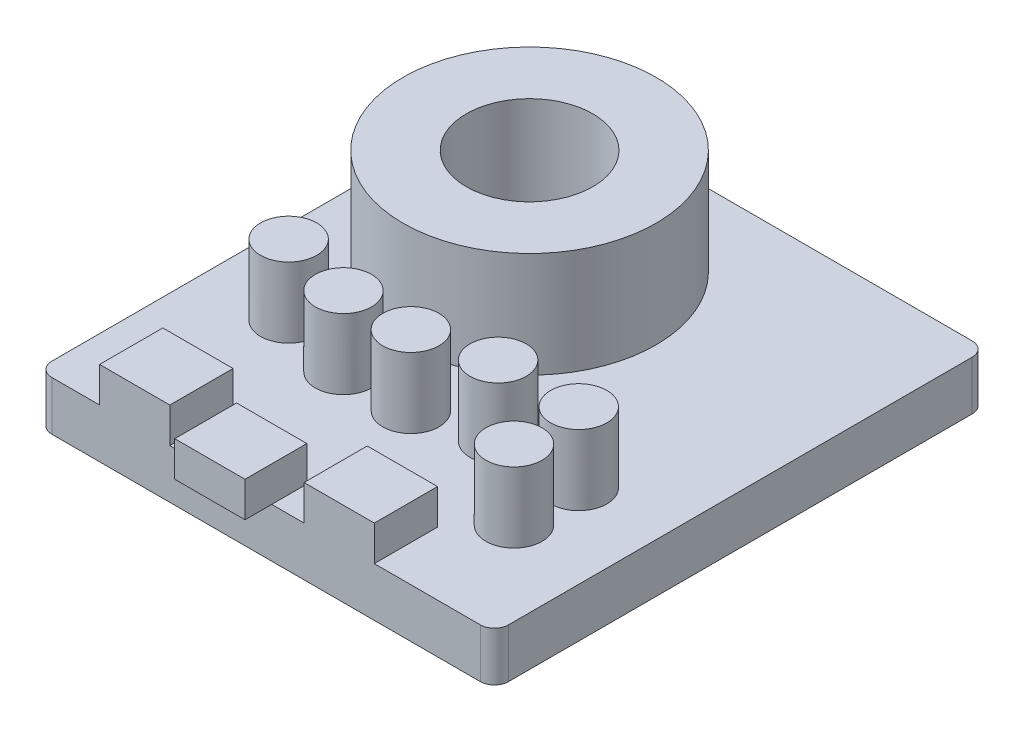
from build123d import *

# Parameters (mm, degrees)
SKETCH_1_W      = 65
SKETCH_1_H      = 70
EXTRUDE_1_DEPTH = 7
FILLET_1_R      = 2
SKETCH_3_R      = 18
SKETCH_3_R_2    = 9
EXTRUDE_2_DEPTH = 15
SKETCH_4_R      = 4
EXTRUDE_3_DEPTH = 10
SKETCH_5_W      = 10
SKETCH_5_H      = 9
SKETCH_5_H_2    = 8.8
EXTRUDE_4_DEPTH = 5


with BuildPart() as part:
    # 草图1 → 凸台-拉伸1 (new body)
    with BuildSketch(Plane(origin=(0, 0, 0), x_dir=(1, 0, 0), z_dir=(0, 1, 0))):
        Rectangle(SKETCH_1_W, SKETCH_1_H)
    extrude(amount=EXTRUDE_1_DEPTH)

    # 圆角1
    fillet_1_edges = [part.edges().sort_by_distance(p)[0] for p in [
        (32.5, 3.5, 35),
        (-32.5, 3.5, 35),
        (-32.5, 3.5, -35),
        (32.5, 3.5, -35),
    ]]
    fillet(fillet_1_edges, radius=FILLET_1_R)

    # 草图3 → 凸台-拉伸2 (add)
    with BuildSketch(Plane(origin=(0, 7, 0), x_dir=(1, 0, 0), z_dir=(0, 1, 0))):
        with Locations(Location((-9.5, 12, 0), (0, 0, 270))):
            Circle(SKETCH_3_R)
        with Locations(Location((-9.5, 12, 0), (0, 0, 270))):
            Circle(SKETCH_3_R_2, mode=Mode.SUBTRACT)
    extrude(amount=EXTRUDE_2_DEPTH)

    # 草图4 → 凸台-拉伸3 (add)
    with BuildSketch(Plane(origin=(0, 7, 0), x_dir=(1, 0, 0), z_dir=(0, 1, 0))):
        with Locations(Location((-20.693709583, -11.099353322, 0), (0, 0, 90))):
            Circle(SKETCH_4_R)
        with Locations(Location((-10.440917108, -13.544973545, 0), (0, 0, 90))):
            Circle(SKETCH_4_R)
        with Locations(Location((9.12404468, -11.099353322, 0), (0, 0, 90))):
            Circle(SKETCH_4_R)
        with Locations(Location((20.599647266, -20.317460317, 0), (0, 0, 90))):
            Circle(SKETCH_4_R)
        with Locations(Location((-0.846560847, -13.544973545, 0), (0, 0, 90))):
            Circle(SKETCH_4_R)
        with Locations(Location((20.599647266, -11.099353322, 0), (0, 0, 90))):
            Circle(SKETCH_4_R)
    extrude(amount=EXTRUDE_3_DEPTH)

    # 草图5 → 凸台-拉伸4 (add)
    with BuildSketch(Plane(origin=(0, 7, 0), x_dir=(1, 0, 0), z_dir=(0, 1, 0))):
        with Locations((-18.7, -30.5)):
            Rectangle(SKETCH_5_W, SKETCH_5_H)
        with Locations((-4.2, -34.4)):
            Rectangle(SKETCH_5_W, SKETCH_5_H_2)
        with Locations((10.4, -30.5)):
            Rectangle(SKETCH_5_W, SKETCH_5_H)
    extrude(amount=EXTRUDE_4_DEPTH)


solid = part.part
